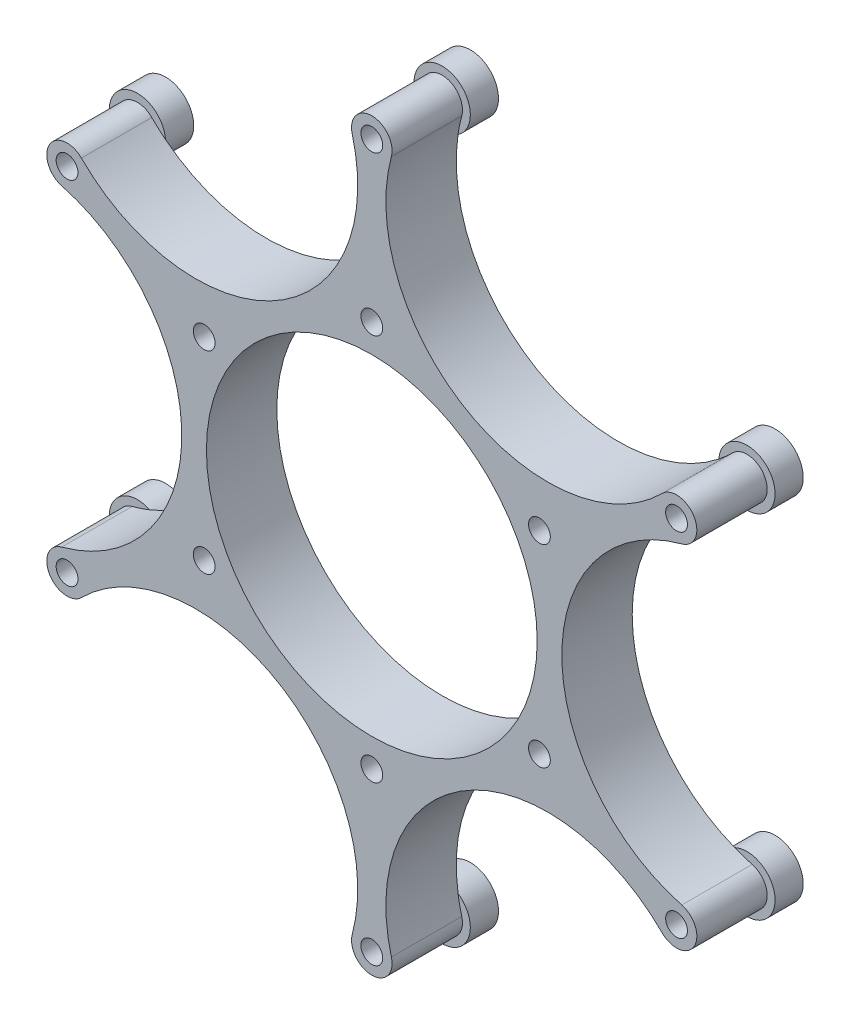
from build123d import *

# Parameters (mm, degrees)
SKETCH_1_R               = 23.5
EXTRUDE_1_DEPTH          = 5
SKETCH_2_R               = 1.55
CUT_EXTRUDE_1_DEPTH      = 10
PATTERN_CIRCULAR_1_COUNT = 6
SKETCH_3_R               = 1.55
CUT_EXTRUDE_2_DEPTH      = 10
SKETCH_4_R               = 4
SKETCH_4_R_2             = 1.5
EXTRUDE_2_DEPTH          = 4
PATTERN_CIRCULAR_2_COUNT = 6


with BuildPart() as part:
    # 草图1 → 凸台-拉伸1 (new, symmetric)
    with BuildSketch(Plane.XY):
        with BuildLine():
            ThreePointArc((-44.047161963, -22.216294005), (-27, 0), (-44.047161963, 22.216294005))
            ThreePointArc((-44.047161963, 22.216294005), (-45.963802781, 23.89714289), (-45.797072706, 26.440952255))
            ThreePointArc((-45.797072706, 26.440952255), (-43.677434211, 27.857249418), (-41.263455967, 27.037814222))
            ThreePointArc((-41.263455967, 27.037814222), (-13.5, 23.382685902), (-2.783705995, 49.254108227))
            ThreePointArc((-2.783705995, 49.254108227), (-2.28636857, 51.754392308), (0, 52.88190451))
            ThreePointArc((0, 52.88190451), (2.28636857, 51.754392308), (2.783705995, 49.254108227))
            ThreePointArc((2.783705995, 49.254108227), (13.5, 23.382685902), (41.263455967, 27.037814222))
            ThreePointArc((41.263455967, 27.037814222), (43.677434211, 27.857249418), (45.797072706, 26.440952255))
            ThreePointArc((45.797072706, 26.440952255), (45.963802781, 23.89714289), (44.047161963, 22.216294005))
            ThreePointArc((44.047161963, 22.216294005), (27, 0), (44.047161963, -22.216294005))
            ThreePointArc((44.047161963, -22.216294005), (45.963802781, -23.89714289), (45.797072706, -26.440952255))
            ThreePointArc((45.797072706, -26.440952255), (43.677434211, -27.857249418), (41.263455967, -27.037814222))
            ThreePointArc((41.263455967, -27.037814222), (13.5, -23.382685902), (2.783705995, -49.254108227))
            ThreePointArc((2.783705995, -49.254108227), (2.28636857, -51.754392308), (0, -52.88190451))
            ThreePointArc((0, -52.88190451), (-2.28636857, -51.754392308), (-2.783705995, -49.254108227))
            ThreePointArc((-2.783705995, -49.254108227), (-13.5, -23.382685902), (-41.263455967, -27.037814222))
            ThreePointArc((-41.263455967, -27.037814222), (-43.677434211, -27.857249418), (-45.797072706, -26.440952255))
            ThreePointArc((-45.797072706, -26.440952255), (-45.963802781, -23.89714289), (-44.047161963, -22.216294005))
        make_face()
        Circle(SKETCH_1_R, mode=Mode.SUBTRACT)
    extrude(amount=EXTRUDE_1_DEPTH, both=True)

    # 草图2 → 切除-拉伸1 (cut)
    with BuildSketch(Plane.XY.offset(5)):
        with Locations((0, 50)):
            Circle(SKETCH_2_R)
    cut_extrude_1 = extrude(amount=-CUT_EXTRUDE_1_DEPTH, mode=Mode.SUBTRACT)

    # 阵列(圆周)1: 切除-拉伸1 ×6 about axis
    pattern_circular_1_axis = Axis((0, 0, 0), (0, 0, 1))
    for i in range(1, PATTERN_CIRCULAR_1_COUNT):
        add(cut_extrude_1.rotate(pattern_circular_1_axis, i * 360 / PATTERN_CIRCULAR_1_COUNT), mode=Mode.SUBTRACT)

    # 草图3 → 切除-拉伸2 (cut)
    with BuildSketch(Plane.XY.offset(5)):
        with Locations((0, 27.5)):
            Circle(SKETCH_3_R)
        with Locations((23.815698604, 13.75)):
            Circle(SKETCH_3_R)
        with Locations((23.815698604, -13.75)):
            Circle(SKETCH_3_R)
        with Locations((0, -27.5)):
            Circle(SKETCH_3_R)
        with Locations((-23.815698604, -13.75)):
            Circle(SKETCH_3_R)
        with Locations((-23.815698604, 13.75)):
            Circle(SKETCH_3_R)
    extrude(amount=-CUT_EXTRUDE_2_DEPTH, mode=Mode.SUBTRACT)

    # 草图4 → 凸台-拉伸2 (add)
    with BuildSketch(Plane(origin=(0, 0, -5), x_dir=(-1, 0, 0), z_dir=(0, 0, -1))):
        with Locations(Location((-43.301270189, 25, 0), (0, 0, 295.743562627))):
            Circle(SKETCH_4_R)
        with Locations((-43.301270189, 25)):
            Circle(SKETCH_4_R_2, mode=Mode.SUBTRACT)
    extrude_2 = extrude(amount=EXTRUDE_2_DEPTH)

    # 阵列(圆周)2: 凸台-拉伸2 ×6 about axis
    pattern_circular_2_axis = Axis((0, 0, 0), (0, 0, 1))
    for i in range(1, PATTERN_CIRCULAR_2_COUNT):
        add(extrude_2.rotate(pattern_circular_2_axis, i * 360 / PATTERN_CIRCULAR_2_COUNT))


solid = part.part
